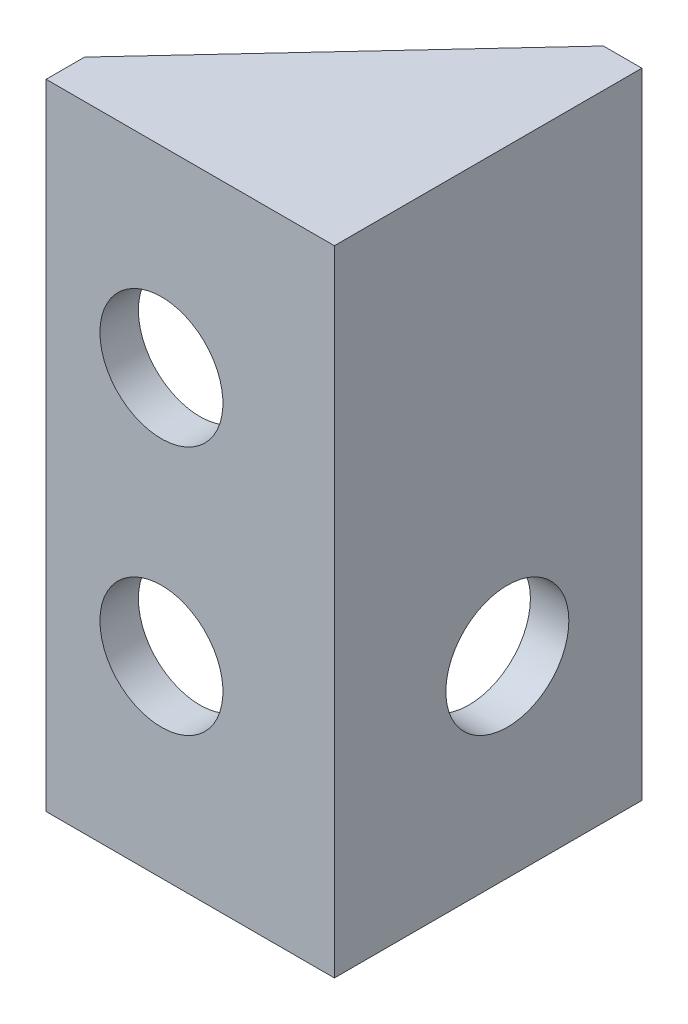
from build123d import *

# Parameters (mm, degrees)
EXTRUDE_1_DEPTH     = 16.5
SKETCH_2_R          = 1.6
CUT_EXTRUDE_1_DEPTH = 6
SKETCH_3_R          = 1.6
CUT_EXTRUDE_2_DEPTH = 10
EXTRUDE_2_DEPTH     = 1
EXTRUDE_3_DEPTH     = 1


with BuildPart() as part:
    # 草图1 → 凸台-拉伸1 (new body)
    with BuildSketch(Plane(origin=(0, 0, 0), x_dir=(1, 0, 0), z_dir=(0, 1, 0))):
        Polygon((0, 0), (7.5, 0), (7.5, 8), (6.5, 8), (6.5, 1), (0, 1), align=None)
    extrude(amount=EXTRUDE_1_DEPTH)

    # 草图2 → 切除-拉伸1 (cut)
    with BuildSketch(Plane(origin=(7.5, 0, 0), x_dir=(0, 0, -1), z_dir=(1, 0, 0))):
        with Locations((4.5, 5)):
            Circle(SKETCH_2_R)
    extrude(amount=-CUT_EXTRUDE_1_DEPTH, mode=Mode.SUBTRACT)

    # 草图3 → 切除-拉伸2 (cut)
    with BuildSketch(Plane(origin=(0, 0, -1), x_dir=(-1, 0, 0), z_dir=(0, 0, -1))):
        with Locations((-3, 5)):
            Circle(SKETCH_3_R)
        with Locations((-3, 11.5)):
            Circle(SKETCH_3_R)
    extrude(amount=-CUT_EXTRUDE_2_DEPTH, mode=Mode.SUBTRACT)

    # 草图4 → 凸台-拉伸2 (add)
    with BuildSketch(Plane.XZ):
        Polygon((0, -1), (6.5, -1), (6.5, -8), align=None)
    extrude(amount=-EXTRUDE_2_DEPTH)

    # 草图5 → 凸台-拉伸3 (add)
    with BuildSketch(Plane(origin=(0, 16.5, 0), x_dir=(1, 0, 0), z_dir=(0, 1, 0))):
        Polygon((0, 1), (6.5, 1), (6.5, 8), align=None)
    extrude(amount=-EXTRUDE_3_DEPTH)


solid = part.part
